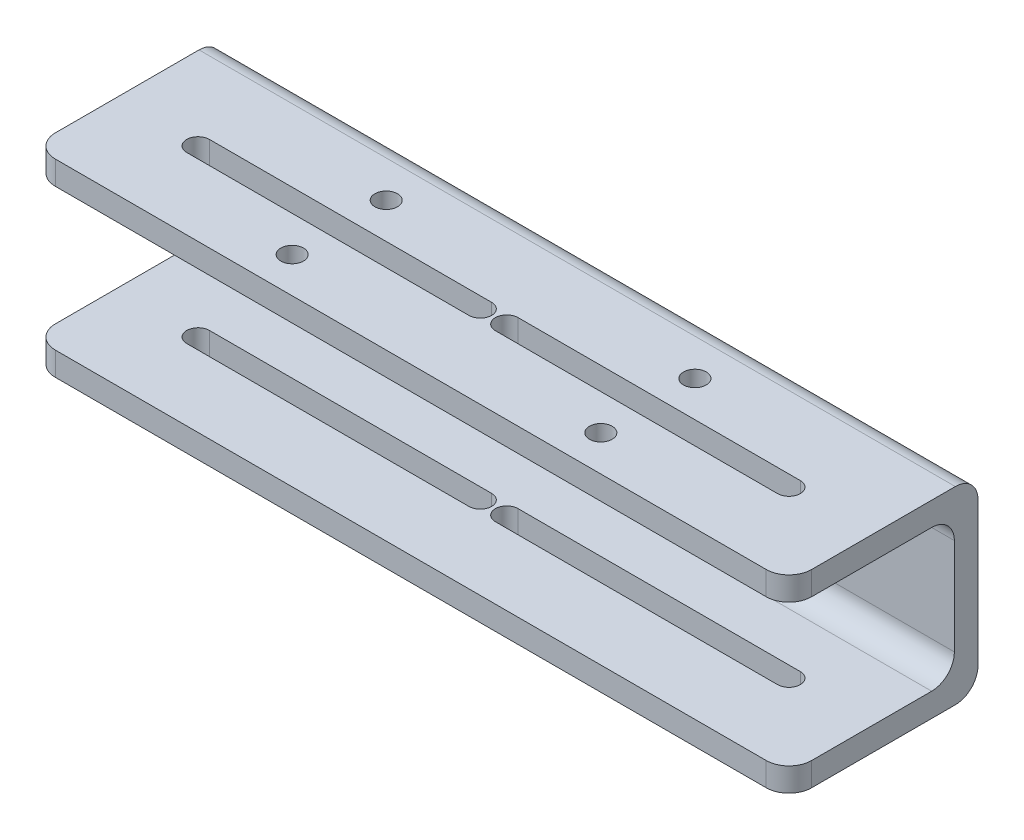
from build123d import *

# Parameters (mm, degrees)
SKETCH2_W           = 101.6
SKETCH2_H           = 25.4
BOSS_EXTRUDE1_DEPTH = 25.4
SKETCH3_W           = 101.6
SKETCH3_H           = 19.05
CUT_EXTRUDE1_DEPTH  = 22.225
CUT_EXTRUDE2_DEPTH  = 25.4
CUT_EXTRUDE3_DEPTH  = 25.4
SKETCH6_R           = 1.524
CUT_EXTRUDE4_DEPTH  = 3.175
SKETCH7_R           = 1.524
CUT_EXTRUDE5_DEPTH  = 3.175
FILLET1_R           = 3.048
FILLET2_R           = 3.048
FILLET3_R           = 3.048


with BuildPart() as part:
    # Sketch2 → Boss-Extrude1 (new body)
    with BuildSketch(Plane(origin=(0, 25.4, 0), x_dir=(1, 0, 0), z_dir=(0, 1, 0))):
        with Locations((25.998060942, 0.45734072)):
            Rectangle(SKETCH2_W, SKETCH2_H)
    extrude(amount=BOSS_EXTRUDE1_DEPTH)

    # Sketch3 → Cut-Extrude1 (cut)
    with BuildSketch(Plane.XY.offset(12.24265928)):
        with Locations((25.998060942, 38.1)):
            Rectangle(SKETCH3_W, SKETCH3_H)
    extrude(amount=-CUT_EXTRUDE1_DEPTH, mode=Mode.SUBTRACT)

    # Sketch4 → Cut-Extrude2 (cut)
    with BuildSketch(Plane(origin=(0, 50.8, 0), x_dir=(1, 0, 0), z_dir=(0, 1, 0))):
        with BuildLine():
            Line((-13.689439058, 0.39384072), (24.220060942, 0.39384072))
            ThreePointArc((24.220060942, 0.39384072), (25.744060942, -1.13015928), (24.220060942, -2.65415928))
            Line((24.220060942, -2.65415928), (-13.689439058, -2.65415928))
            ThreePointArc((-13.689439058, -2.65415928), (-15.213439058, -1.13015928), (-13.689439058, 0.39384072))
        make_face()
    extrude(amount=-CUT_EXTRUDE2_DEPTH, mode=Mode.SUBTRACT)

    # Sketch5 → Cut-Extrude3 (cut)
    with BuildSketch(Plane(origin=(0, 50.8, 0), x_dir=(1, 0, 0), z_dir=(0, 1, 0))):
        with BuildLine():
            Line((27.776060942, 0.39384072), (65.685560942, 0.39384072))
            ThreePointArc((65.685560942, 0.39384072), (67.209560942, -1.13015928), (65.685560942, -2.65415928))
            Line((65.685560942, -2.65415928), (27.776060942, -2.65415928))
            ThreePointArc((27.776060942, -2.65415928), (26.252060942, -1.13015928), (27.776060942, 0.39384072))
        make_face()
    extrude(amount=-CUT_EXTRUDE3_DEPTH, mode=Mode.SUBTRACT)

    # Sketch6 → Cut-Extrude4 (cut)
    with BuildSketch(Plane(origin=(0, 50.8, 0), x_dir=(1, 0, 0), z_dir=(0, 1, 0))):
        with Locations(Location((5.265310942, -7.44840928, 0), (0, 0, 270))):
            Circle(SKETCH6_R)
        with Locations(Location((5.265310942, 5.18809072, 0), (0, 0, 270))):
            Circle(SKETCH6_R)
        with Locations(Location((46.730810942, 5.18809072, 0), (0, 0, 270))):
            Circle(SKETCH6_R)
        with Locations(Location((46.730810942, -7.44840928, 0), (0, 0, 270))):
            Circle(SKETCH6_R)
    extrude(amount=-CUT_EXTRUDE4_DEPTH, mode=Mode.SUBTRACT)

    # Sketch7 → Cut-Extrude5 (cut)
    with BuildSketch(Plane(origin=(0, 0, -13.15734072), x_dir=(-1, 0, 0), z_dir=(0, 0, -1))):
        with Locations((-56.478060942, 38.1)):
            Circle(SKETCH7_R)
        with Locations((-36.158060942, 38.1)):
            Circle(SKETCH7_R)
        with Locations((-15.838060942, 38.1)):
            Circle(SKETCH7_R)
        with Locations((4.481939058, 38.1)):
            Circle(SKETCH7_R)
    extrude(amount=-CUT_EXTRUDE5_DEPTH, mode=Mode.SUBTRACT)

    # Fillet1
    fillet1_edges = [part.edges().sort_by_distance(p)[0] for p in [
        (25.998060942, 47.625, -9.98234072),
        (25.998060942, 28.575, -9.98234072),
    ]]
    fillet(fillet1_edges, radius=FILLET1_R)

    # Fillet2
    fillet2_edges = [part.edges().sort_by_distance(p)[0] for p in [
        (25.998060942, 50.8, -13.15734072),
        (25.998060942, 25.4, -13.15734072),
    ]]
    fillet(fillet2_edges, radius=FILLET2_R)

    # Fillet3
    fillet3_edges = [part.edges().sort_by_distance(p)[0] for p in [
        (76.798060942, 26.9875, 12.24265928),
        (-24.801939058, 26.9875, 12.24265928),
        (76.798060942, 49.2125, 12.24265928),
        (-24.801939058, 49.2125, 12.24265928),
    ]]
    fillet(fillet3_edges, radius=FILLET3_R)


solid = part.part
